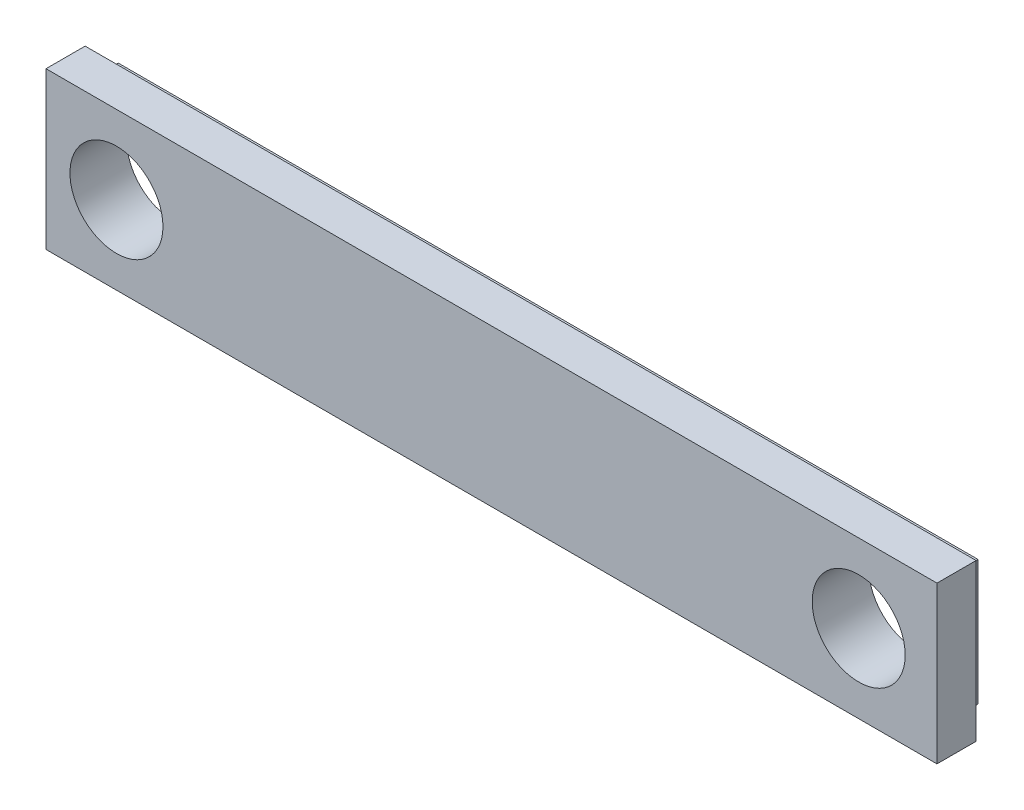
from build123d import *

# Parameters (mm, degrees)
SKETCH1_W           = 54.9
SKETCH1_H           = 8
SKETCH1_R           = 2.97
BOSS_EXTRUDE1_DEPTH = 1.12
SKETCH2_W           = 56.9
SKETCH2_H           = 10
SKETCH2_R           = 2.97
BOSS_EXTRUDE3_DEPTH = 2.5


with BuildPart() as part:
    # Sketch1 → Boss-Extrude1 (new body)
    with BuildSketch(Plane.XY):
        with Locations((-189.35, 6)):
            Rectangle(SKETCH1_W, SKETCH1_H)
        with Locations((-165.9, 6)):
            Circle(SKETCH1_R, mode=Mode.SUBTRACT)
        with Locations((-213.3, 6)):
            Circle(SKETCH1_R, mode=Mode.SUBTRACT)
    extrude(amount=BOSS_EXTRUDE1_DEPTH)

    # Sketch2 → Boss-Extrude3 (add)
    with BuildSketch(Plane.XY.offset(1.12)):
        with Locations((-189.35, 6)):
            Rectangle(SKETCH2_W, SKETCH2_H)
        with Locations((-213.3, 6)):
            Circle(SKETCH2_R, mode=Mode.SUBTRACT)
        with Locations((-165.9, 6)):
            Circle(SKETCH2_R, mode=Mode.SUBTRACT)
    extrude(amount=BOSS_EXTRUDE3_DEPTH)


solid = part.part
